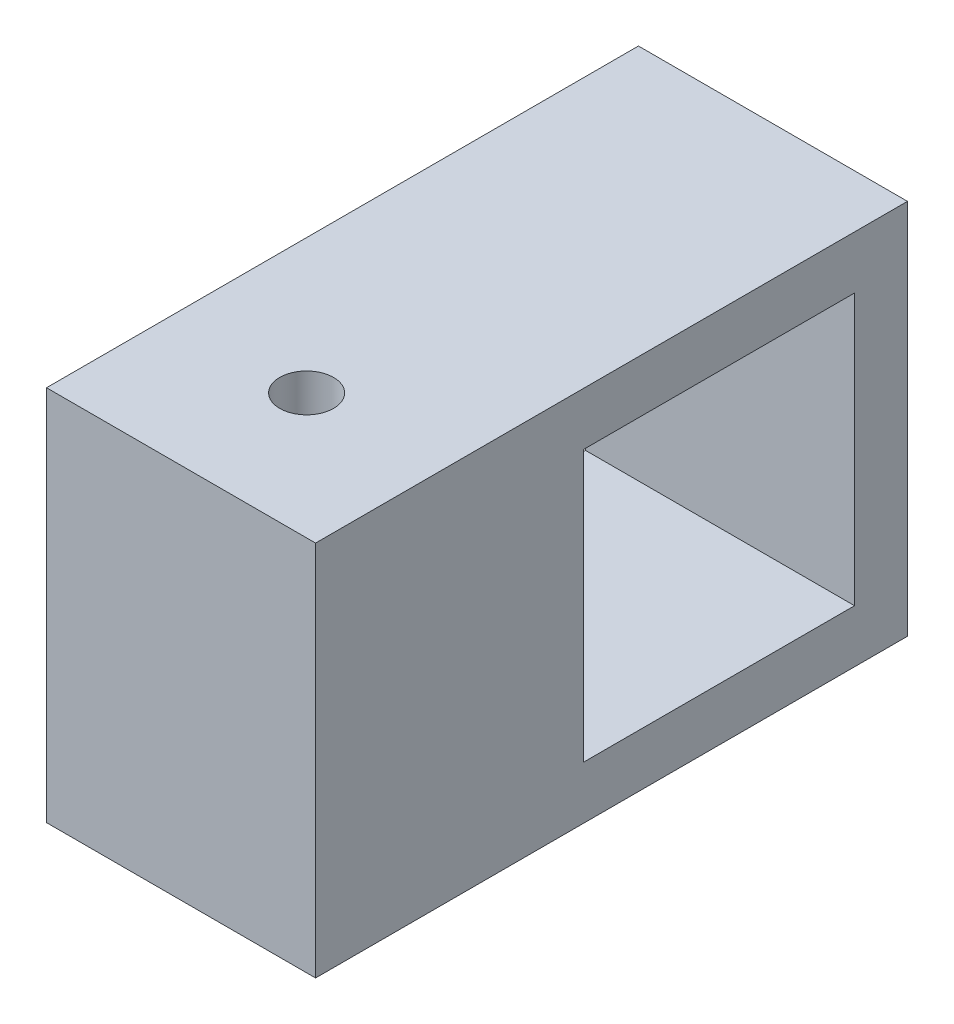
from build123d import *

# Parameters (mm, degrees)
SCHIZZO1_W                   = 12
SCHIZZO1_H                   = 21
SCHIZZO1_W_2                 = 21
SCHIZZO1_W_3                 = 15.1
SCHIZZO1_H_2                 = 15.1
ESTRUSIONE_ESTRUSIONE1_DEPTH = 15
SCHIZZO2_R                   = 1.5
TAGLIO_ESTRUSIONE1_DEPTH     = 15
SCHIZZO3_R                   = 1.5
TAGLIO_ESTRUSIONE2_DEPTH     = 15


with BuildPart() as part:
    # Schizzo1 → Estrusione-Estrusione1 (new body)
    # profile 1 of 2: a face of its own
    with BuildSketch(Plane(origin=(0, 0, 0), x_dir=(0, 0, -1), z_dir=(1, 0, 0))):
        with Locations((-16.5, 0)):
            Rectangle(SCHIZZO1_W, SCHIZZO1_H)
    # profile 2 of 2: a face of its own
    with BuildSketch(Plane(origin=(0, 0, 0), x_dir=(0, 0, -1), z_dir=(1, 0, 0))):
        Rectangle(SCHIZZO1_W_2, SCHIZZO1_H)
        Rectangle(SCHIZZO1_W_3, SCHIZZO1_H_2, mode=Mode.SUBTRACT)
    extrude(amount=ESTRUSIONE_ESTRUSIONE1_DEPTH)

    # Schizzo2 → Taglio-Estrusione1 (cut)
    with BuildSketch(Plane(origin=(0, 10.5, 0), x_dir=(1, 0, 0), z_dir=(0, 1, 0))):
        with Locations(Location((7.5, -15.5, 0), (0, 0, 270))):
            Circle(SCHIZZO2_R)
    extrude(amount=-TAGLIO_ESTRUSIONE1_DEPTH, mode=Mode.SUBTRACT)

    # Schizzo3 → Taglio-Estrusione2 (cut)
    with BuildSketch(Plane.XZ.offset(10.5)):
        with Locations(Location((7.5, 19.5, 0), (0, 0, 270))):
            Circle(SCHIZZO3_R)
    extrude(amount=-TAGLIO_ESTRUSIONE2_DEPTH, mode=Mode.SUBTRACT)


solid = part.part
